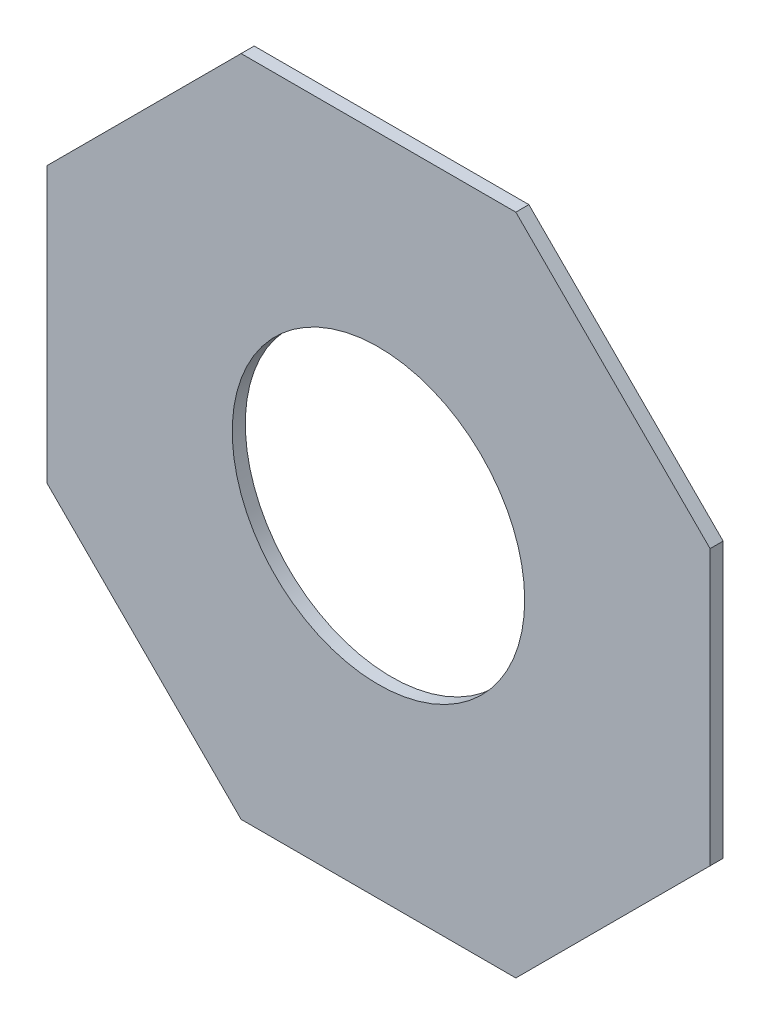
from build123d import *

# Parameters (mm, degrees)
SKIZZE1_R               = 0.56
COMPONENT_OUTLINE_DEPTH = 0.05


with BuildPart() as part:
    # Skizze1 → Component_Outline (new body)
    with BuildSketch(Plane.XY):
        Polygon((1.27, 0.526051224), (0.526051224, 1.27), (-0.526051224, 1.27), (-1.27, 0.526051224), (-1.27, -0.526051224), (-0.526051224, -1.27), (0.526051224, -1.27), (1.27, -0.526051224), align=None)
        Circle(SKIZZE1_R, mode=Mode.SUBTRACT)
    extrude(amount=COMPONENT_OUTLINE_DEPTH)


solid = part.part
